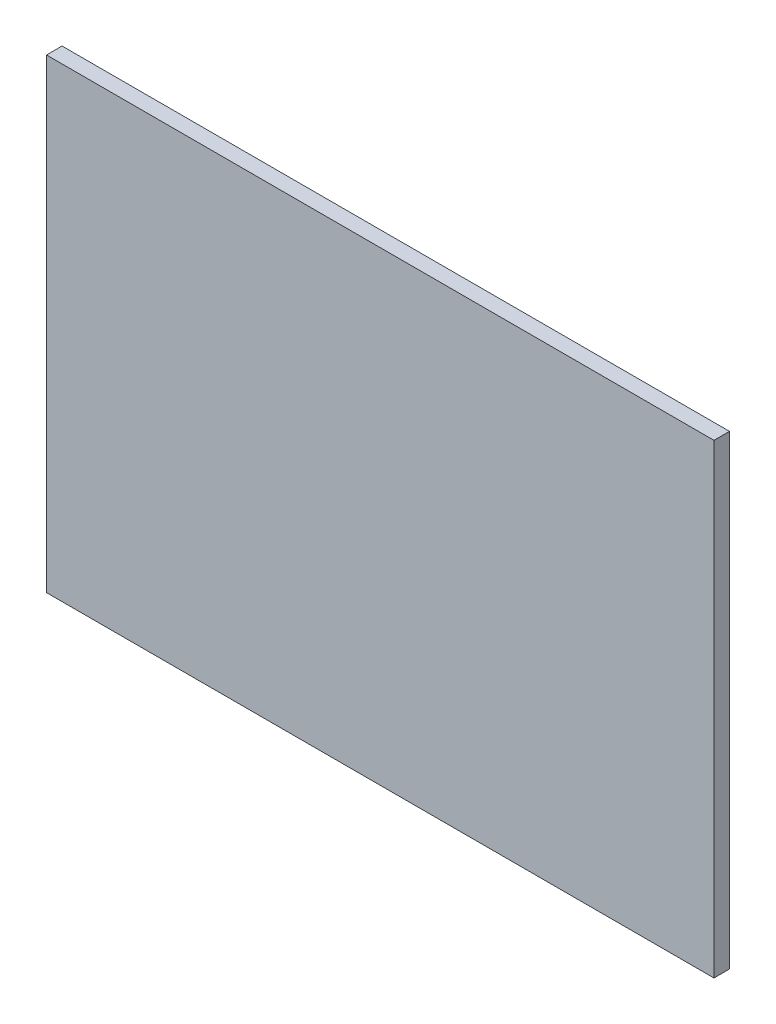
from build123d import *

# Parameters (mm, degrees)
SKETCH1_W           = 430
SKETCH1_H           = 300
BOSS_EXTRUDE1_DEPTH = 10


with BuildPart() as part:
    # Sketch1 → Boss-Extrude1 (new body)
    with BuildSketch(Plane.XY):
        with Locations((52.43902439, 150)):
            Rectangle(SKETCH1_W, SKETCH1_H)
    extrude(amount=BOSS_EXTRUDE1_DEPTH)


solid = part.part
